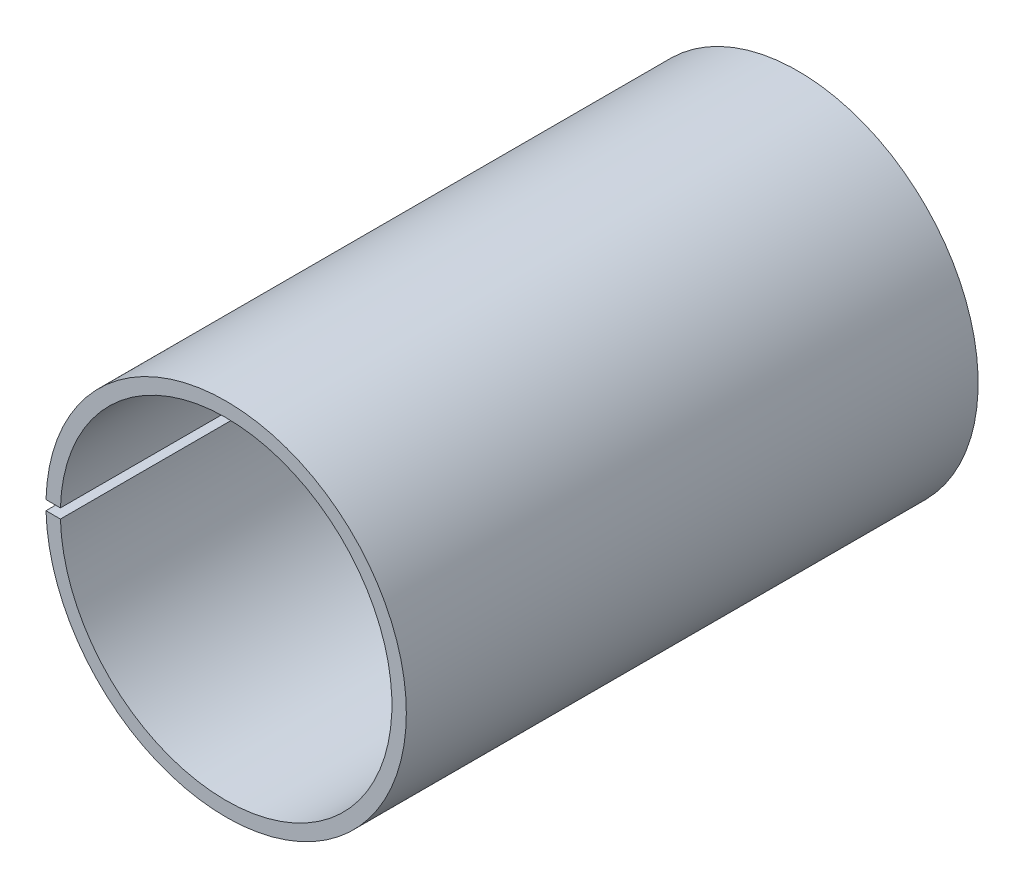
from build123d import *

# Parameters (mm, degrees)
SKETCH_2_R               = 37.5
SKETCH_2_R_2             = 34.5
EXTRUDE_1_DEPTH          = 59.5
CUT_EXTRUDE_1_REACH      = 81.704
CUT_EXTRUDE_1_END_RADIUS = 37.5
CUT_EXTRUDE_2_REACH      = 81.704
CUT_EXTRUDE_2_END_RADIUS = 37.5
SKETCH_4_W               = 119
SKETCH_4_H               = 2


with BuildPart() as part:
    # 草图2 → 凸台-拉伸1 (new, symmetric)
    with BuildSketch(Plane.XY):
        Circle(SKETCH_2_R)
        Circle(SKETCH_2_R_2, mode=Mode.SUBTRACT)
    extrude(amount=EXTRUDE_1_DEPTH, both=True)

    # 切除-拉伸1: up to this cylinder (the profile starts inside it)
    cut_extrude_1_end = Plane(origin=(0, 0, -50.003604), z_dir=(0, 0, -1)) * Cylinder(CUT_EXTRUDE_1_END_RADIUS, 239.408, mode=Mode.PRIVATE)
    # 草图3 → 切除-拉伸1 (cut, up to the surface)
    with BuildSketch(Plane(origin=(0, 0, 0), x_dir=(0, 0, -1), z_dir=(1, 0, 0)), mode=Mode.PRIVATE) as cut_extrude_1_sk1:
        with BuildLine():
            Line((44.5, -5), (59.5, -5))
            Line((59.5, -5), (59.5, 5))
            Line((59.5, 5), (44.5, 5))
            ThreePointArc((44.5, 5), (39.5, 0), (44.5, -5))
        make_face()
    cut_extrude_1_tool1 = extrude(cut_extrude_1_sk1.sketch, amount=-CUT_EXTRUDE_1_REACH, mode=Mode.PRIVATE) & cut_extrude_1_end
    add(cut_extrude_1_tool1.solids().sort_by_distance((0, 0, -50.003604))[0], mode=Mode.SUBTRACT)

    # 切除-拉伸2: up to this cylinder (the profile starts inside it)
    cut_extrude_2_end = Plane(origin=(0, 0, 0), z_dir=(0, 0, -1)) * Cylinder(CUT_EXTRUDE_2_END_RADIUS, 239.408, mode=Mode.PRIVATE)
    # 草图4 → 切除-拉伸2 (cut, up to the surface)
    with BuildSketch(Plane(origin=(0, 0, 0), x_dir=(0, 0, -1), z_dir=(1, 0, 0)), mode=Mode.PRIVATE) as cut_extrude_2_sk1:
        Rectangle(SKETCH_4_W, SKETCH_4_H)
    cut_extrude_2_tool1 = extrude(cut_extrude_2_sk1.sketch, amount=-CUT_EXTRUDE_2_REACH, mode=Mode.PRIVATE) & cut_extrude_2_end
    add(cut_extrude_2_tool1.solids().sort_by_distance((0, 0, 0))[0], mode=Mode.SUBTRACT)


solid = part.part
